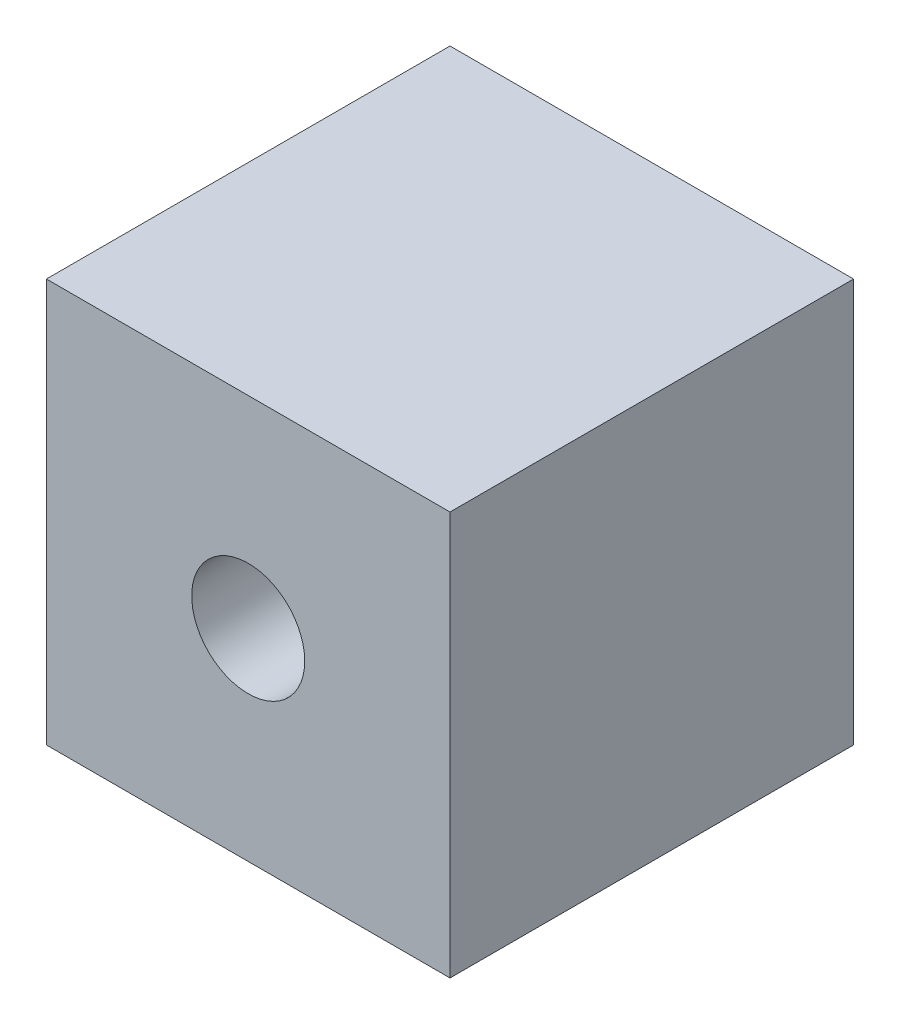
from build123d import *

# Parameters (mm, degrees)
SKETCH_1_W      = 10
SKETCH_1_H      = 10
SKETCH_1_R      = 1.4
EXTRUDE_1_DEPTH = 10


with BuildPart() as part:
    # 스케치1 → 보스-돌출1 (new body)
    with BuildSketch(Plane.XY):
        Rectangle(SKETCH_1_W, SKETCH_1_H)
        Circle(SKETCH_1_R, mode=Mode.SUBTRACT)
    extrude(amount=EXTRUDE_1_DEPTH)


solid = part.part
